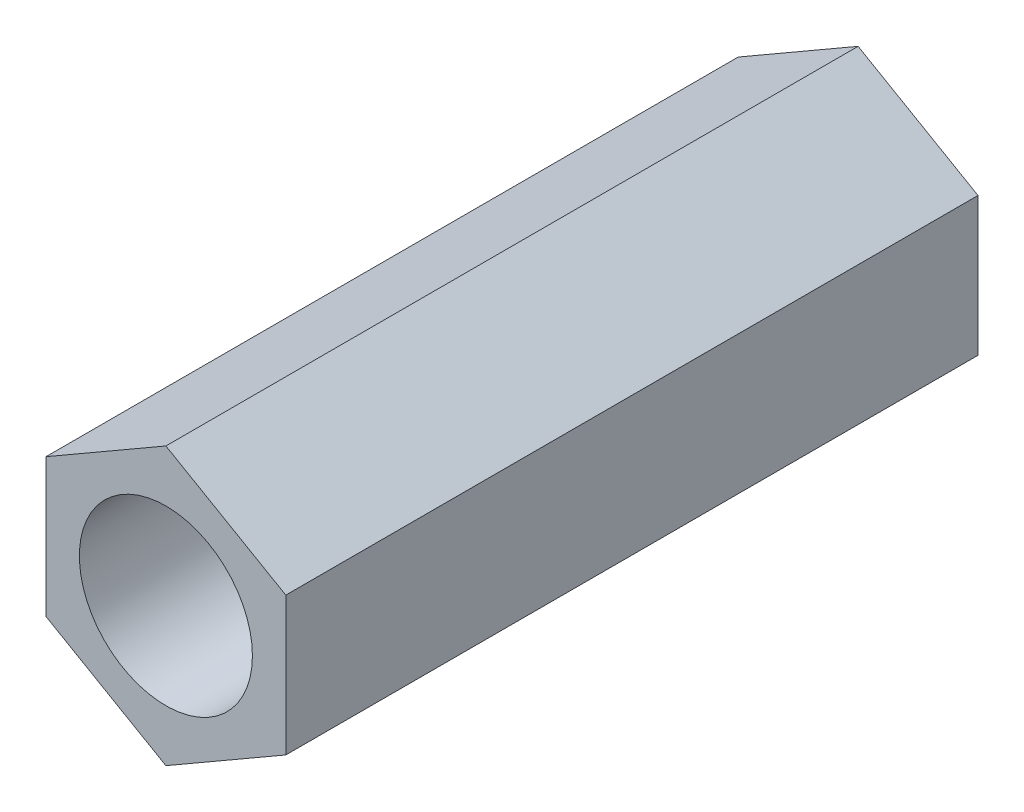
from build123d import *

# Parameters (mm, degrees)
SKETCH1_R           = 0.25
BOSS_EXTRUDE1_DEPTH = 2


with BuildPart() as part:
    # Sketch1 → Boss-Extrude1 (new body)
    with BuildSketch(Plane.XY):
        Polygon((0, 0.4), (-0.346410162, 0.2), (-0.346410162, -0.2), (0, -0.4), (0.346410162, -0.2), (0.346410162, 0.2), align=None)
        Circle(SKETCH1_R, mode=Mode.SUBTRACT)
    extrude(amount=BOSS_EXTRUDE1_DEPTH)


solid = part.part
